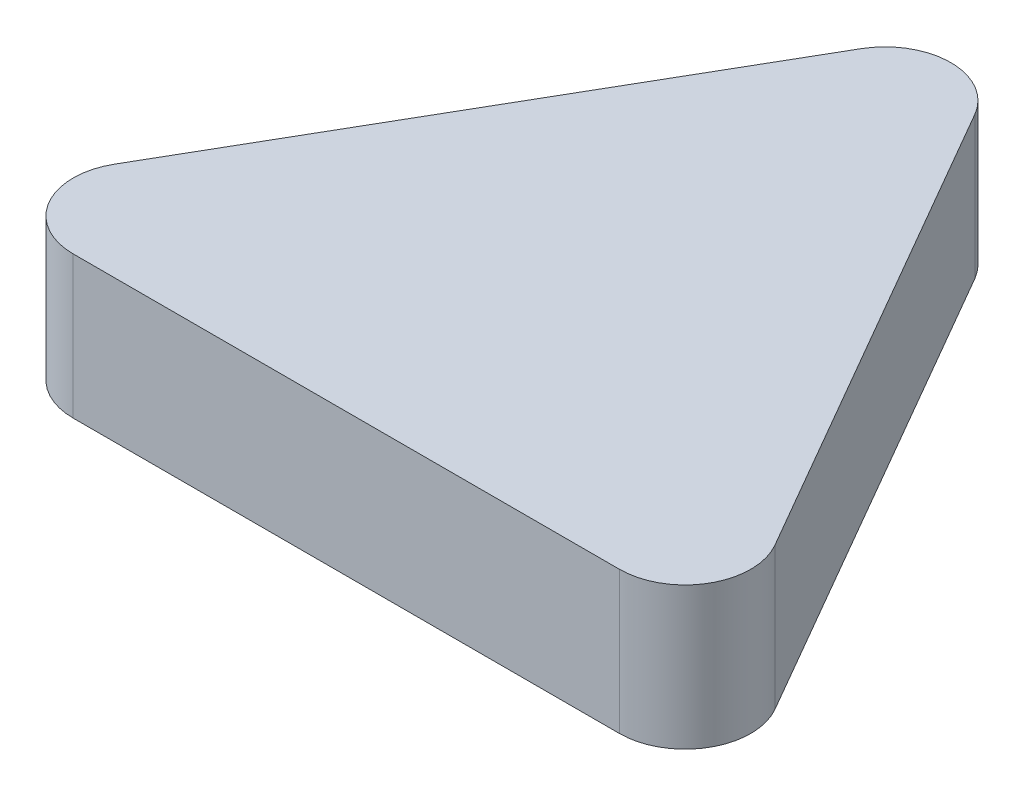
from build123d import *

# Parameters (mm, degrees)
BOSS_EXTRUDE1_DEPTH = 6.35
CUT_EXTRUDE1_DEPTH  = 2.413


with BuildPart() as part:
    # Sketch1 → Boss-Extrude1 (new body)
    with BuildSketch(Plane(origin=(0, 0, 0), x_dir=(1, 0, 0), z_dir=(0, 1, 0))):
        with BuildLine():
            Line((2.54, 25.521030316), (14.734573723, 4.399409051))
            ThreePointArc((14.734573723, 4.399409051), (14.734573723, 1.466469684), (12.194573723, 0))
            Line((12.194573723, 0), (-12.194573723, 0))
            ThreePointArc((-12.194573723, 0), (-14.734573723, 1.466469684), (-14.734573723, 4.399409051))
            Line((-14.734573723, 4.399409051), (-2.54, 25.521030316))
            ThreePointArc((-2.54, 25.521030316), (0, 26.9875), (2.54, 25.521030316))
        make_face()
    extrude(amount=BOSS_EXTRUDE1_DEPTH)

    # Sketch2 → Cut-Extrude1 (cut)
    with BuildSketch(Plane.XZ):
        with BuildLine():
            Line((-13.579728847, -3.732659051), (-1.385155124, -24.854280316))
            ThreePointArc((-1.385155124, -24.854280316), (0, -25.654), (1.385155124, -24.854280316))
            Line((1.385155124, -24.854280316), (13.579728847, -3.732659051))
            ThreePointArc((13.579728847, -3.732659051), (13.579728847, -2.133219684), (12.194573723, -1.3335))
            Line((12.194573723, -1.3335), (-12.194573723, -1.3335))
            ThreePointArc((-12.194573723, -1.3335), (-13.579728847, -2.133219684), (-13.579728847, -3.732659051))
        make_face()
    extrude(amount=-CUT_EXTRUDE1_DEPTH, mode=Mode.SUBTRACT)


solid = part.part
